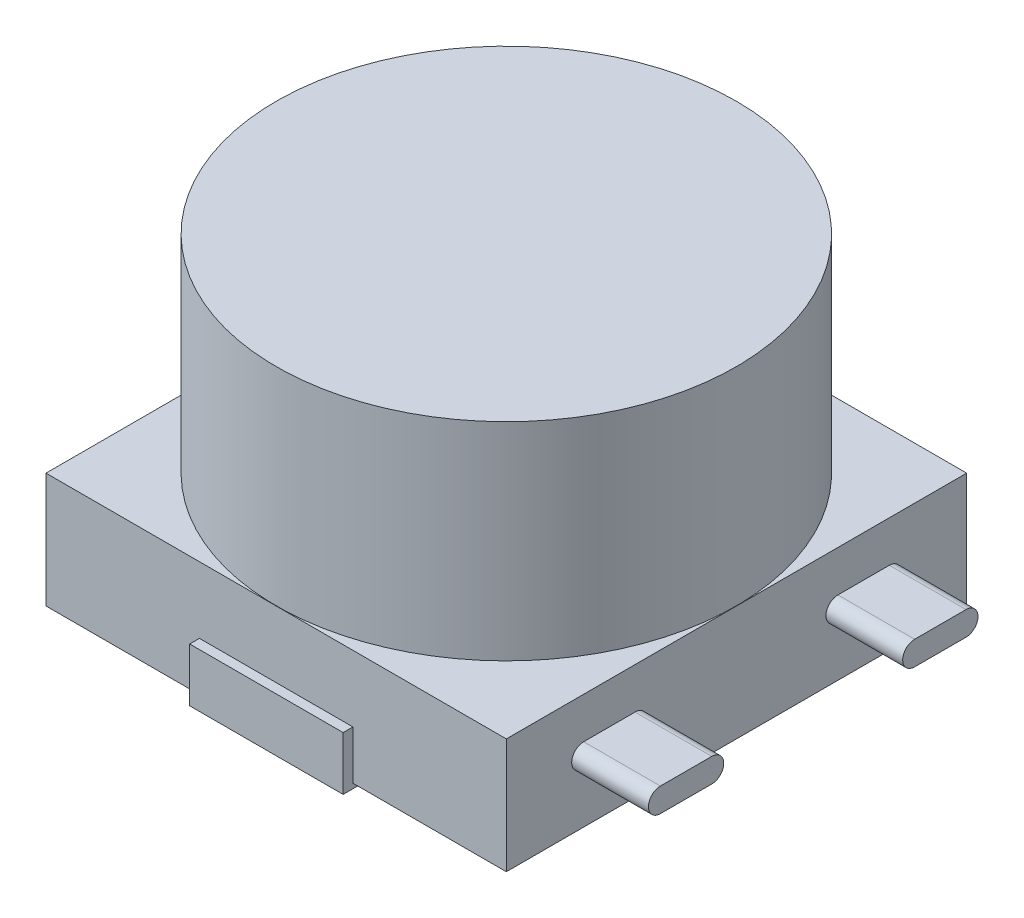
from build123d import *

# Parameters (mm, degrees)
SKETCH1_W                = 12
SKETCH1_H                = 12
BOSS_EXTRUDE1_DEPTH      = 3
SKETCH2_R                = 5.995277692
BOSS_EXTRUDE2_DEPTH      = 5.4
BOSS_EXTRUDE3_DEPTH      = 2
BOSS_EXTRUDE4_DEPTH      = 0.127
BOSS_EXTRUDE4_DEPTH_BACK = 1.27
SKETCH4_W                = 4
SKETCH4_H                = 3


with BuildPart() as part:
    # Sketch1 → Boss-Extrude1 (new body)
    with BuildSketch(Plane(origin=(0, 0, 0), x_dir=(1, 0, 0), z_dir=(0, 1, 0))):
        Rectangle(SKETCH1_W, SKETCH1_H)
    extrude(amount=BOSS_EXTRUDE1_DEPTH)

    # Sketch2 → Boss-Extrude2 (add)
    with BuildSketch(Plane(origin=(0, 3, 0), x_dir=(1, 0, 0), z_dir=(0, 1, 0))):
        with Locations(Location((0, 0, 0), (0, 0, 90))):
            Circle(SKETCH2_R)
    extrude(amount=BOSS_EXTRUDE2_DEPTH)

    # Sketch3 → Boss-Extrude3 (add)
    with BuildSketch(Plane(origin=(6, 0, 0), x_dir=(0, 0, -1), z_dir=(1, 0, 0))):
        with BuildLine():
            Line((-3.983677321, 1.927671256), (-2.644454293, 1.927671256))
            ThreePointArc((-2.644454293, 1.927671256), (-2.332402325, 1.615619288), (-2.644454293, 1.303567321))
            Line((-2.644454293, 1.303567321), (-3.983677321, 1.303567321))
            ThreePointArc((-3.983677321, 1.303567321), (-4.295729288, 1.615619288), (-3.983677321, 1.927671256))
        make_face()
        with BuildLine():
            Line((3.983677321, 1.927671256), (2.644454293, 1.927671256))
            ThreePointArc((2.644454293, 1.927671256), (2.332402325, 1.615619288), (2.644454293, 1.303567321))
            Line((2.644454293, 1.303567321), (3.983677321, 1.303567321))
            ThreePointArc((3.983677321, 1.303567321), (4.295729288, 1.615619288), (3.983677321, 1.927671256))
        make_face()
    extrude(amount=BOSS_EXTRUDE3_DEPTH)

    # Sketch4 → Boss-Extrude4 (add, two sides: drawn at the far end of the back side and taken through both)
    with BuildSketch(Plane.XZ.offset(-BOSS_EXTRUDE4_DEPTH_BACK)):
        with Locations((0, 4.754)):
            Rectangle(SKETCH4_W, SKETCH4_H)
        with Locations((0, -4.754)):
            Rectangle(SKETCH4_W, SKETCH4_H)
    extrude(amount=BOSS_EXTRUDE4_DEPTH + BOSS_EXTRUDE4_DEPTH_BACK)


solid = part.part
